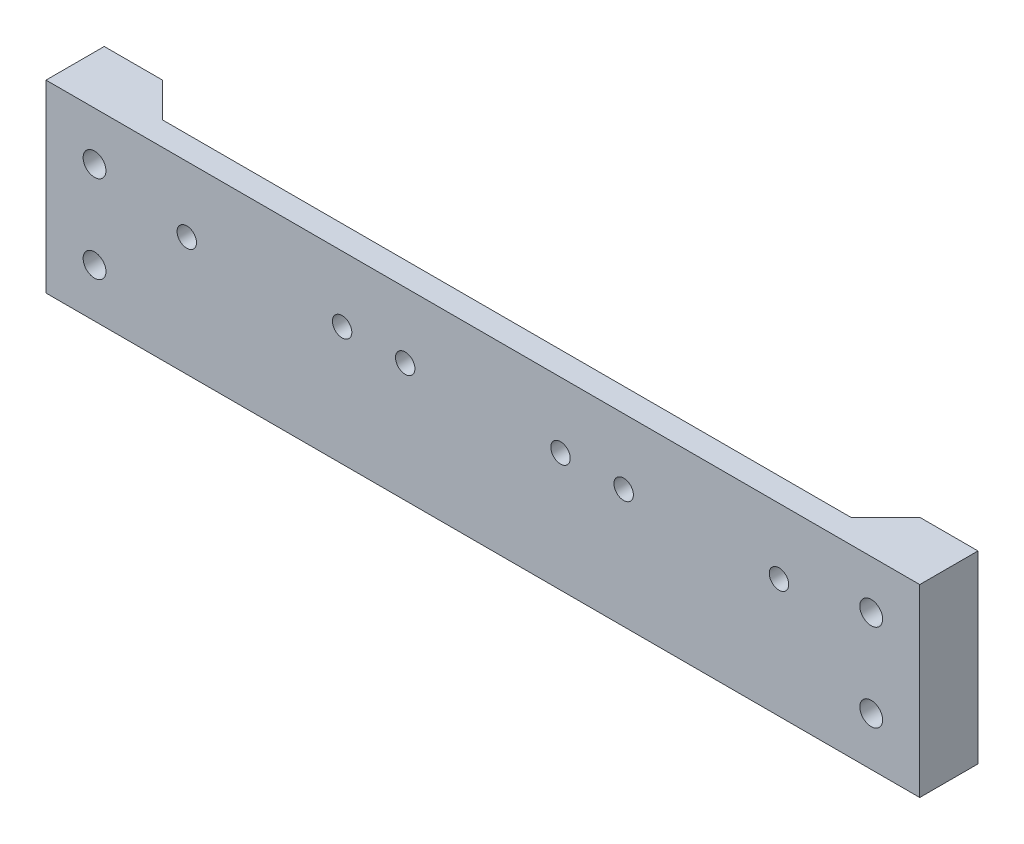
from build123d import *

# Parameters (mm, degrees)
SKETCH1_W           = 180
SKETCH1_H           = 38
SKETCH1_R           = 2.35
BOSS_EXTRUDE1_DEPTH = 12
CUT_EXTRUDE1_DEPTH  = 38
SKETCH3_R           = 2
CUT_EXTRUDE2_DEPTH  = 22


with BuildPart() as part:
    # Sketch1 → Boss-Extrude1 (new body)
    with BuildSketch(Plane.XY):
        with Locations((90, -19)):
            Rectangle(SKETCH1_W, SKETCH1_H)
        with Locations((170, -10)):
            Circle(SKETCH1_R, mode=Mode.SUBTRACT)
        with Locations((170, -27.996930787)):
            Circle(SKETCH1_R, mode=Mode.SUBTRACT)
        with Locations((10, -10)):
            Circle(SKETCH1_R, mode=Mode.SUBTRACT)
        with Locations((10, -27.996930787)):
            Circle(SKETCH1_R, mode=Mode.SUBTRACT)
    extrude(amount=BOSS_EXTRUDE1_DEPTH)

    # Sketch2 → Cut-Extrude1 (cut)
    with BuildSketch(Plane(origin=(0, 0, 0), x_dir=(1, 0, 0), z_dir=(0, 1, 0))):
        Polygon((168, 0), (160.9, -7.1), (19.1, -7.1), (12, 0), align=None)
    extrude(amount=-CUT_EXTRUDE1_DEPTH, mode=Mode.SUBTRACT)

    # Sketch3 → Cut-Extrude2 (cut)
    with BuildSketch(Plane.XY.offset(12)):
        with Locations((151, -13.5)):
            Circle(SKETCH3_R)
        with Locations((119, -13.5)):
            Circle(SKETCH3_R)
        with Locations((106, -13.5)):
            Circle(SKETCH3_R)
        with Locations((74, -13.5)):
            Circle(SKETCH3_R)
        with Locations((61, -13.5)):
            Circle(SKETCH3_R)
        with Locations((29, -13.5)):
            Circle(SKETCH3_R)
    extrude(amount=-CUT_EXTRUDE2_DEPTH, mode=Mode.SUBTRACT)


solid = part.part
